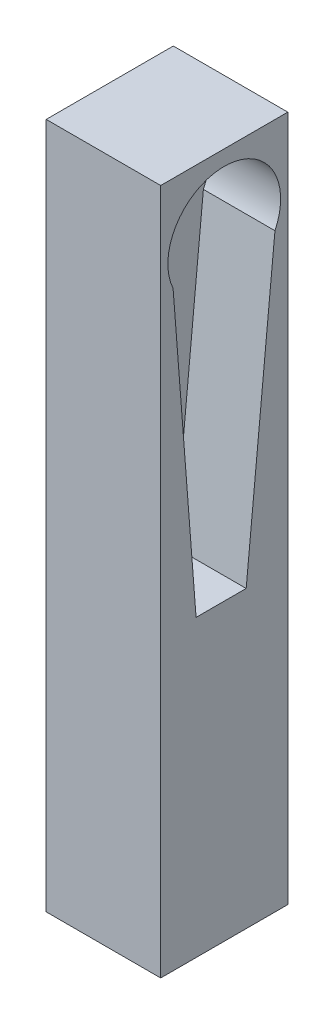
from build123d import *

# Parameters (mm, degrees)
BOSS_EXTRUDE1_DEPTH = 8
SKETCH1_3_R         = 1.5
BOSS_EXTRUDE2_DEPTH = 3
BOSS_EXTRUDE5_START = -8
BOSS_EXTRUDE5_DEPTH = 8


with BuildPart() as part:
    # Sketch1 → Boss-Extrude1 (new body)
    with BuildSketch(Plane(origin=(0, 0, 0), x_dir=(0, 0, -1), z_dir=(1, 0, 0))):
        with BuildLine():
            ThreePointArc((-4.119669775, -1.65532903), (0.037822774, 4.439635423), (4.090869231, -1.725277422))
            Line((4.090869231, -1.725277422), (1.82908276, -24.946763134))
            Line((1.82908276, -24.946763134), (-2.312399702, -24.946763134))
            Line((-2.312399702, -24.946763134), (-4.119669775, -1.65532903))
        make_face()
        with BuildLine():
            Line((-3.575175872, -1.65532903), (-1.968294835, -22.364222709))
            Line((-1.968294835, -22.364222709), (1.531705165, -22.364222709))
            Line((1.531705165, -22.364222709), (3.541950668, -1.725277422))
            ThreePointArc((3.541950668, -1.725277422), (0.038719155, 3.939606268), (-3.575175872, -1.65532903))
        make_face(mode=Mode.SUBTRACT)
    extrude(amount=BOSS_EXTRUDE1_DEPTH)

    # Sketch1<3> → Boss-Extrude2 (add)
    with BuildSketch(Plane(origin=(0, 0, 0), x_dir=(0, 0, -1), z_dir=(1, 0, 0))):
        with BuildLine():
            ThreePointArc((-3.575175872, -1.65532903), (0.038719155, 3.939606268), (3.541950668, -1.725277422))
            Line((3.541950668, -1.725277422), (1.531705165, -22.364222709))
            Line((1.531705165, -22.364222709), (-1.968294835, -22.364222709))
            Line((-1.968294835, -22.364222709), (-3.575175872, -1.65532903))
        make_face()
        Circle(SKETCH1_3_R, mode=Mode.SUBTRACT)
    extrude(amount=BOSS_EXTRUDE2_DEPTH)

    # Sketch4 → Boss-Extrude5 (add)
    with BuildSketch(Plane(origin=(8, 0, 0), x_dir=(0, 0, -1), z_dir=(1, 0, 0)).offset(BOSS_EXTRUDE5_START)):
        with BuildLine():
            Line((4.439796532, 5.000361233), (-4.439796532, 5.000361233))
            Line((-4.439796532, 5.000361233), (-4.439796532, -2e-08))
            ThreePointArc((-4.439796532, -2e-08), (1e-08, 4.439796532), (4.439796532, -4e-08))
            Line((4.439796532, -4e-08), (4.439796532, 5.000361233))
        make_face()
        with BuildLine():
            ThreePointArc((-4.119669775, -1.65532903), (-4.359030213, -0.842999912), (-4.439796532, -2e-08))
            Line((-4.439796532, -2e-08), (-4.439796532, -42.946763134))
            Line((-4.439796532, -42.946763134), (4.439796532, -42.946763134))
            Line((4.439796532, -42.946763134), (4.439796532, -4e-08))
            ThreePointArc((4.439796532, -4e-08), (4.351690488, -0.880104054), (4.090869231, -1.725277422))
            Line((4.090869231, -1.725277422), (1.82908276, -24.946763134))
            Line((1.82908276, -24.946763134), (-2.312399702, -24.946763134))
            Line((-2.312399702, -24.946763134), (-4.119669775, -1.65532903))
        make_face()
    extrude(amount=BOSS_EXTRUDE5_DEPTH)


solid = part.part
